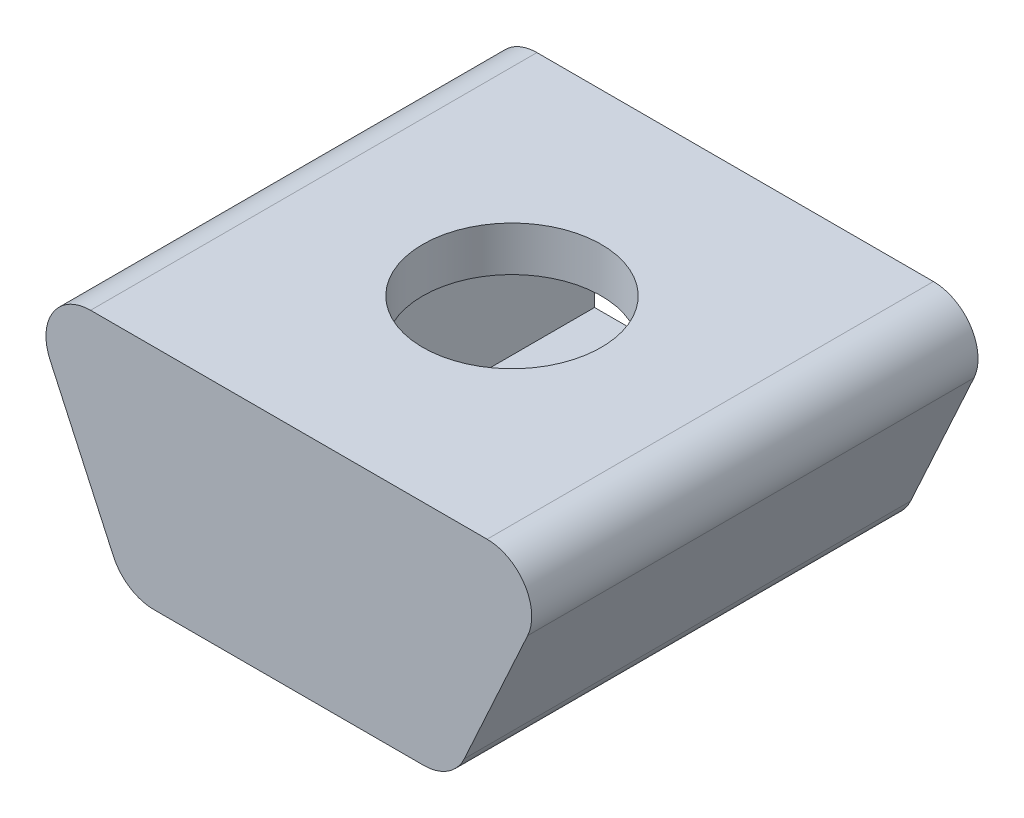
from build123d import *

# Parameters (mm, degrees)
SKETCH1_W           = 6.3
SKETCH1_H           = 3.3
BOSS_EXTRUDE1_DEPTH = 8
BOSS_EXTRUDE2_DEPTH = 2
SKETCH2_R           = 2
CUT_EXTRUDE1_DEPTH  = 1
FILLET1_R           = 1


with BuildPart() as part:
    # Sketch1 → Boss-Extrude1 (new body)
    with BuildSketch(Plane.XY):
        Polygon((-6, 2.65), (6, 2.65), (3.663445075, -2.45), (-3.663445075, -2.45), align=None)
        Rectangle(SKETCH1_W, SKETCH1_H, mode=Mode.SUBTRACT)
    extrude(amount=-BOSS_EXTRUDE1_DEPTH)

    # Sketch1<2> → Boss-Extrude2 (add)
    with BuildSketch(Plane.XY):
        Polygon((-6, 2.65), (6, 2.65), (3.663445075, -2.45), (-3.663445075, -2.45), align=None)
    extrude(amount=BOSS_EXTRUDE2_DEPTH)

    # Sketch2 → Cut-Extrude1 (cut)
    with BuildSketch(Plane(origin=(0, 2.65, 0), x_dir=(1, 0, 0), z_dir=(0, 1, 0))):
        with Locations(Location((0, 3, 0), (0, 0, 180))):
            Circle(SKETCH2_R)
    extrude(amount=-CUT_EXTRUDE1_DEPTH, mode=Mode.SUBTRACT)

    # Fillet1
    fillet1_edges = [part.edges().sort_by_distance(p)[0] for p in [
        (-6, 2.65, -3),
        (6, 2.65, -3),
        (3.663445075, -2.45, -3),
        (-3.663445075, -2.45, -3),
    ]]
    fillet(fillet1_edges, radius=FILLET1_R)


solid = part.part
